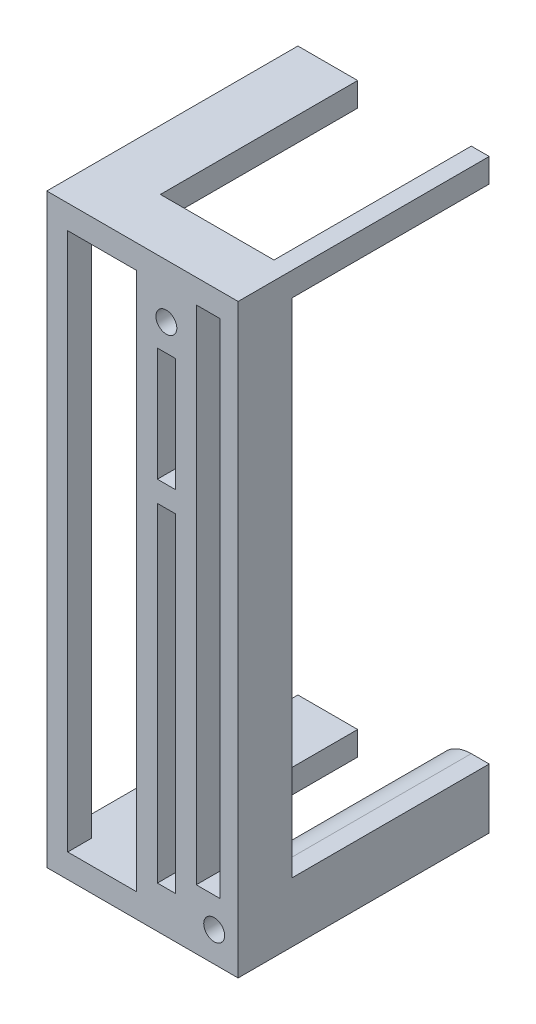
from build123d import *

# Parameters (mm, degrees)
SKETCH1_W           = 32
SKETCH1_H           = 98
SKETCH1_W_2         = 3
SKETCH1_H_2         = 55
SKETCH1_R           = 1.75
BOSS_EXTRUDE1_DEPTH = 4
BOSS_EXTRUDE3_DEPTH = 5
SKETCH1_31_W        = 10
SKETCH1_31_H        = 4
SKETCH1_31_W_2      = 3
SKETCH1_31_W_3      = 9
SKETCH1_31_H_2      = 10
BOSS_EXTRUDE4_DEPTH = 38
SKETCH3_R           = 1.75
CUT_EXTRUDE1_DEPTH  = 112.319360401
FILLET1_R           = 6
SKETCH4_W           = 4
SKETCH4_H           = 84
SKETCH4_W_2         = 11.5
SKETCH4_H_2         = 90
SKETCH4_W_3         = 3
SKETCH4_H_3         = 19
CUT_EXTRUDE2_DEPTH  = 110.872653559


with BuildPart() as part:
    # Sketch1 → Boss-Extrude1 (new body)
    with BuildSketch(Plane.XY):
        with Locations((16, 49)):
            Rectangle(SKETCH1_W, SKETCH1_H)
        with Locations((20, 34.5)):
            Rectangle(SKETCH1_W_2, SKETCH1_H_2, mode=Mode.SUBTRACT)
        with Locations((20, 89)):
            Circle(SKETCH1_R, mode=Mode.SUBTRACT)
    extrude(amount=BOSS_EXTRUDE1_DEPTH)

    # Sketch1<30> → Boss-Extrude3 (add)
    with BuildSketch(Plane.XY):
        Polygon((0, 98), (0, 94), (29, 94), (29, 10), (23, 10), (23, 4), (0, 4), (0, 0), (32, 0), (32, 98), align=None)
    extrude(amount=-BOSS_EXTRUDE3_DEPTH)

    # Sketch1<31> → Boss-Extrude4 (add)
    with BuildSketch(Plane.XY):
        with Locations((5, 96)):
            Rectangle(SKETCH1_31_W, SKETCH1_31_H)
        with Locations((5, 2)):
            Rectangle(SKETCH1_31_W, SKETCH1_31_H)
        with Locations((30.5, 96)):
            Rectangle(SKETCH1_31_W_2, SKETCH1_31_H)
        with Locations((27.5, 5)):
            Rectangle(SKETCH1_31_W_3, SKETCH1_31_H_2)
    extrude(amount=-BOSS_EXTRUDE4_DEPTH)

    # Sketch3 → Cut-Extrude1 (cut, through all)
    with BuildSketch(Plane(origin=(0, 0, -38), x_dir=(-1, 0, 0), z_dir=(0, 0, -1))):
        with Locations((-28, 5)):
            Circle(SKETCH3_R)
    extrude(amount=-CUT_EXTRUDE1_DEPTH, mode=Mode.SUBTRACT)

    # Fillet1
    fillet1_edges = [part.edges().sort_by_distance(p)[0] for p in [
        (23, 10, -19),
    ]]
    fillet(fillet1_edges, radius=FILLET1_R)

    # Sketch4 → Cut-Extrude2 (cut, through all)
    with BuildSketch(Plane(origin=(0, 0, 0), x_dir=(-1, 0, 0), z_dir=(0, 0, -1))):
        with Locations((-27, 52)):
            Rectangle(SKETCH4_W, SKETCH4_H)
        with Locations((-9.25, 49)):
            Rectangle(SKETCH4_W_2, SKETCH4_H_2)
        with Locations((-20, 75)):
            Rectangle(SKETCH4_W_3, SKETCH4_H_3)
    extrude(amount=-CUT_EXTRUDE2_DEPTH, mode=Mode.SUBTRACT)


solid = part.part
